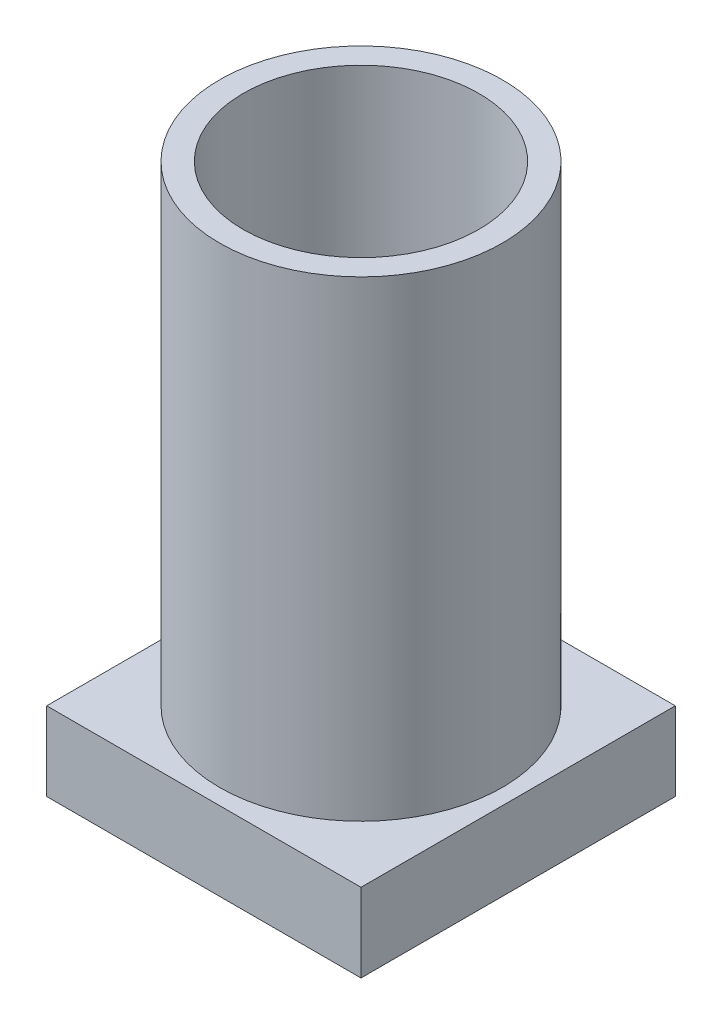
from build123d import *

# Parameters (mm, degrees)
SKETCH1_W           = 40
SKETCH1_H           = 40
BOSS_EXTRUDE1_DEPTH = 10
SKETCH2_R           = 18
SKETCH2_R_2         = 15
BOSS_EXTRUDE2_DEPTH = 60


with BuildPart() as part:
    # Sketch1 → Boss-Extrude1 (new body)
    with BuildSketch(Plane(origin=(0, 0, 0), x_dir=(1, 0, 0), z_dir=(0, 1, 0))):
        with Locations((20, -20)):
            Rectangle(SKETCH1_W, SKETCH1_H)
    extrude(amount=BOSS_EXTRUDE1_DEPTH)

    # Sketch2 → Boss-Extrude2 (add)
    with BuildSketch(Plane(origin=(0, 10, 0), x_dir=(1, 0, 0), z_dir=(0, 1, 0))):
        with Locations(Location((20, -20, 0), (0, 0, 270))):
            Circle(SKETCH2_R)
        with Locations(Location((20, -20, 0), (0, 0, 270))):
            Circle(SKETCH2_R_2, mode=Mode.SUBTRACT)
    extrude(amount=BOSS_EXTRUDE2_DEPTH)


solid = part.part
